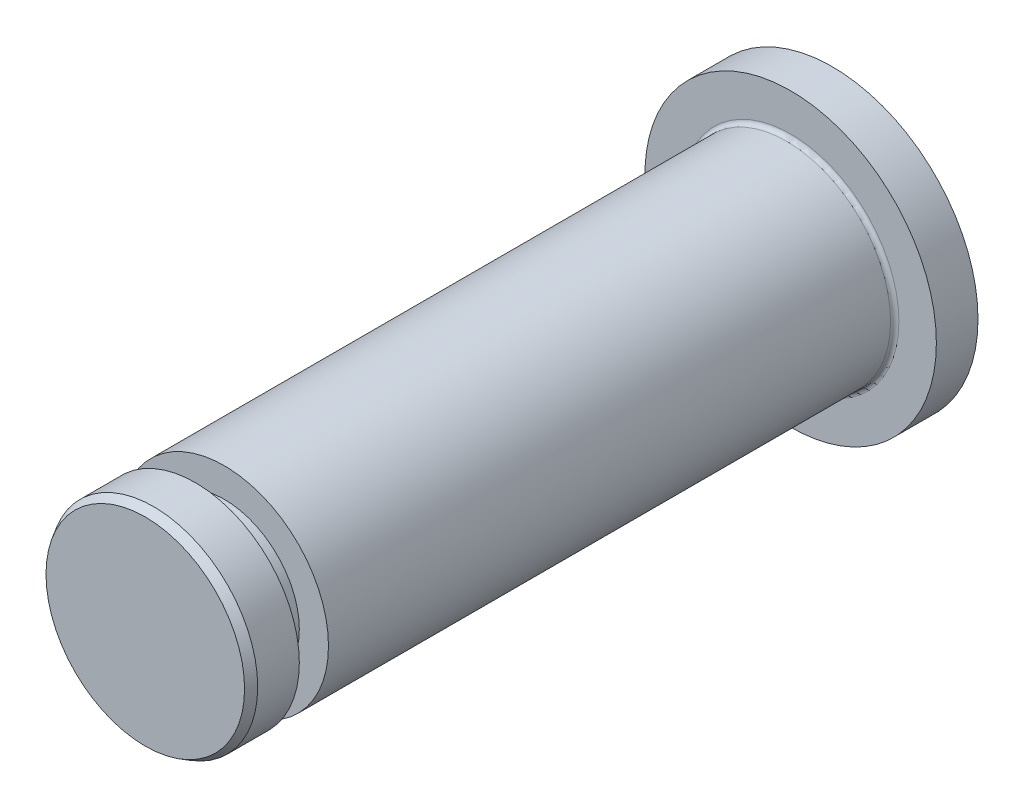
from build123d import *

# Parameters (mm, degrees)
SKETCH_1_R      = 35
EXTRUDE_1_DEPTH = 10
SKETCH_2_R      = 25
EXTRUDE_2_DEPTH = 136
SKETCH_3_R      = 18
EXTRUDE_3_DEPTH = 7
SKETCH_4_R      = 25
EXTRUDE_4_DEPTH = 12
CHAMFER_1_SIZE  = 2
CHAMFER_1_SIZE2 = 1.154700538
FILLET_1_R      = 1


with BuildPart() as part:
    # 草图1 → 凸台-拉伸1 (new body)
    with BuildSketch(Plane.XY):
        Circle(SKETCH_1_R)
    extrude(amount=EXTRUDE_1_DEPTH)

    # 草图2 → 凸台-拉伸2 (add)
    with BuildSketch(Plane.XY.offset(10)):
        Circle(SKETCH_2_R)
    extrude(amount=EXTRUDE_2_DEPTH)

    # 草图3 → 凸台-拉伸3 (add)
    with BuildSketch(Plane.XY.offset(146)):
        Circle(SKETCH_3_R)
    extrude(amount=EXTRUDE_3_DEPTH)

    # 草图4 → 凸台-拉伸4 (add)
    with BuildSketch(Plane.XY.offset(153)):
        Circle(SKETCH_4_R)
    extrude(amount=EXTRUDE_4_DEPTH)

    # 倒角1
    chamfer_1_edges = [part.edges().sort_by_distance(p)[0] for p in [
        (-25, 0, 165),
    ]]
    chamfer_1_side = [part.faces().sort_by_distance(p)[0] for p in [
        (-25, 0, 159),
    ]]
    chamfer(chamfer_1_edges, length=CHAMFER_1_SIZE, length2=CHAMFER_1_SIZE2, reference=chamfer_1_side[0])

    # 圆角1
    fillet_1_edges = [part.edges().sort_by_distance(p)[0] for p in [
        (-25, 0, 10),
    ]]
    fillet(fillet_1_edges, radius=FILLET_1_R)


solid = part.part
